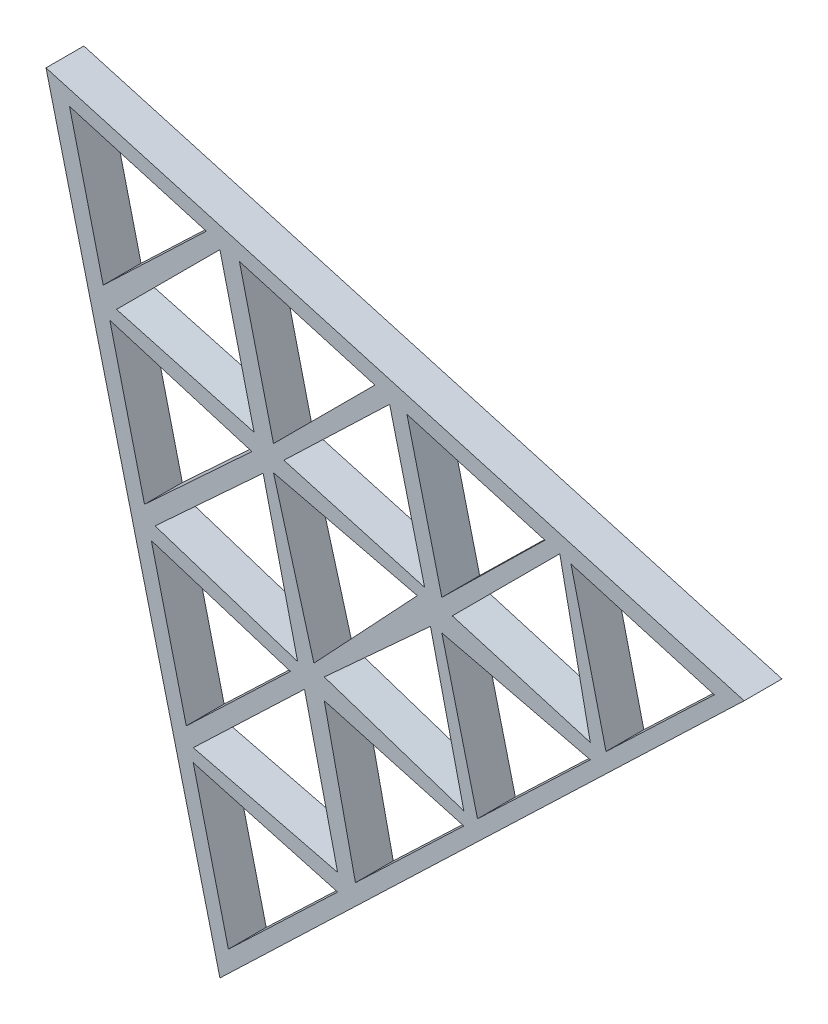
from build123d import *

# Parameters (mm, degrees)
RESSALTO_EXTRUS_O1_DEPTH = 10


with BuildPart() as part:
    # Esboço1 → Ressalto-extrusão1 (new body)
    with BuildSketch(Plane.XY):
        Polygon((-126.238515457, 94.285443038), (-80.275914767, -91.055638665), (58.278900907, 41.674126668), align=None)
        Polygon((-120.027353202, 88.571173763), (-111.121083647, 52.102898426), (-83.875189284, 78.078561997), align=None, mode=Mode.SUBTRACT)
        Polygon((-78.039896355, -83.353797468), (-49.163405973, -55.823557892), (-87.332121667, -45.305158912), align=None, mode=Mode.SUBTRACT)
        Polygon((-107.605028691, 48.322842348), (-80.275914767, 75.651956272), (-71.247120871, 38.363415453), align=None, mode=Mode.SUBTRACT)
        Polygon((-75.120650095, 75.537691107), (-66.114464824, 38.342522964), (-39.312161848, 65.14482594), align=None, mode=Mode.SUBTRACT)
        Polygon((-109.376188137, 44.95811918), (-71.828734099, 33.664499425), (-100.202444106, 7.394622908), align=None, mode=Mode.SUBTRACT)
        Polygon((-30.847981962, 62.688227391), (-21.624691556, 25.38847633), (5.623637916, 52.102898426), align=None, mode=Mode.SUBTRACT)
        Polygon((-68.847376217, 30.186248562), (-97.418722592, 3.850920598), (-59.73906137, -8.361685457), align=None, mode=Mode.SUBTRACT)
        Polygon((-63.381553432, 35.900517837), (-35.418223954, 62.688227391), (-26.168285688, 25.38847633), align=None, mode=Mode.SUBTRACT)
        Polygon((-18.862754173, 22.543823465), (9.555234971, 50.961812609), (17.612002379, 11.801208285), align=None, mode=Mode.SUBTRACT)
        Polygon((12.511037677, 50.103936153), (21.768265533, 11.801208285), (50.407351595, 39.105111568), align=None, mode=Mode.SUBTRACT)
        Polygon((-98.396531864, 0), (-61.642428, -11.552761795), (-89.166567856, -37.793698777), align=None, mode=Mode.SUBTRACT)
        Polygon((-66.114464824, 31.676927503), (-55.431265745, -6.583831991), (-28.102151821, 22.543823465), align=None, mode=Mode.SUBTRACT)
        Polygon((-52.698354353, -8.361685457), (-24.623900958, 17.26703107), (-15.813359557, -20.575447504), align=None, mode=Mode.SUBTRACT)
        Polygon((-44.457092929, -51.33665786), (-52.698354353, -13.788780207), (-15.813359557, -24.02832393), align=None, mode=Mode.SUBTRACT)
        Polygon((-21.624691556, 17.26703107), (-12.191634703, -20.575447504), (17.612002379, 7.838714269), align=None, mode=Mode.SUBTRACT)
        Polygon((-57.915730647, -13.788780207), (-49.163405973, -51.33665786), (-87.332121667, -41.863233602), align=None, mode=Mode.SUBTRACT)
    extrude(amount=RESSALTO_EXTRUS_O1_DEPTH)


solid = part.part
